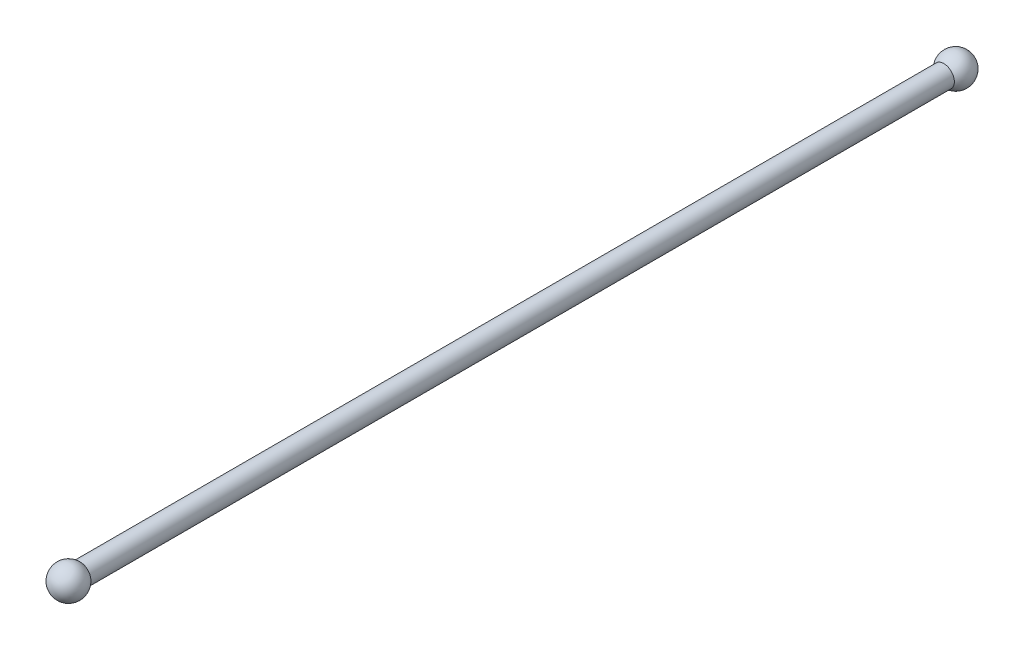
from build123d import *


with BuildPart() as part:
    # Sketch3 → Revolve1 (revolve)
    with BuildSketch(Plane(origin=(0, 0, 0), x_dir=(1, 0, 0), z_dir=(0, 1, 0))):
        with BuildLine():
            Line((-4, 330.527864045), (-4, 4.472135955))
            ThreePointArc((-4, 4.472135955), (-5.605034154, -2.140932539), (0, -6))
            Line((0, -6), (0, 341))
            ThreePointArc((0, 341), (-5.605034154, 337.140932539), (-4, 330.527864045))
        make_face()
    revolve(axis=Axis((0, 0, 0), (0, 0, -1)))


solid = part.part
